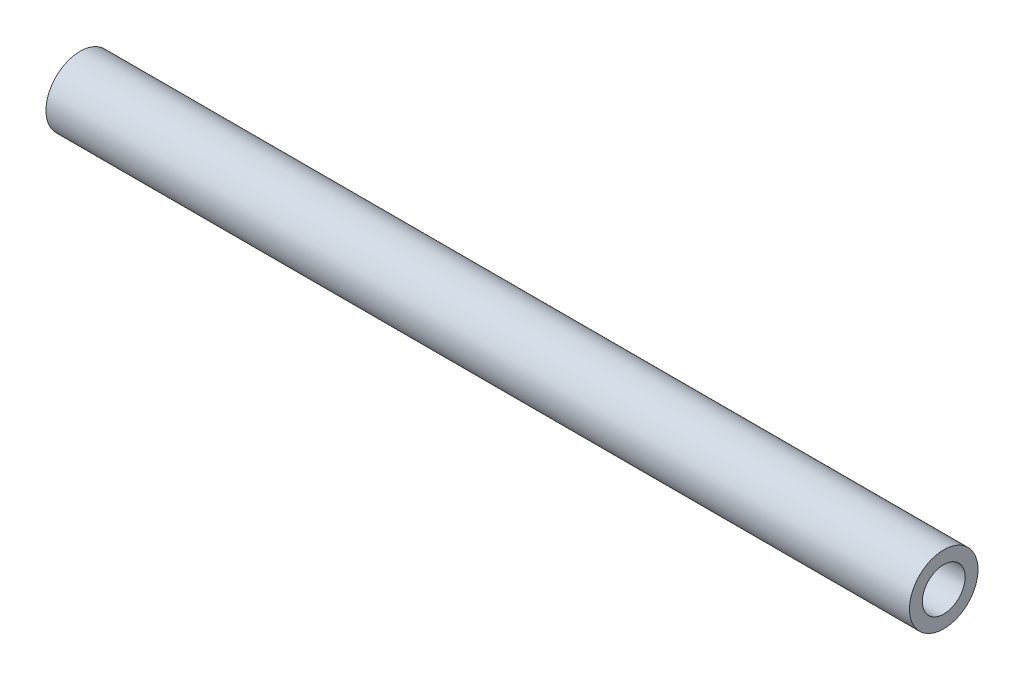
from build123d import *

# Parameters (mm, degrees)
SKETCH1_R                       = 3.175
BOSS_EXTRUDE1_DEPTH             = 80.01
F_5_32_0_15625_DIAMETER_HOLE1_D = 3.96875


with BuildPart() as part:
    # Sketch1 → Boss-Extrude1 (new body)
    with BuildSketch(Plane(origin=(0, 0, 0), x_dir=(0, 0, -1), z_dir=(1, 0, 0))):
        Circle(SKETCH1_R)
    extrude(amount=BOSS_EXTRUDE1_DEPTH)

    # 5/32 (0.15625) Diameter Hole1 (through all)
    with Locations(Plane.ZY):
        with Locations((0, 0)):
            Hole(F_5_32_0_15625_DIAMETER_HOLE1_D / 2)


solid = part.part
